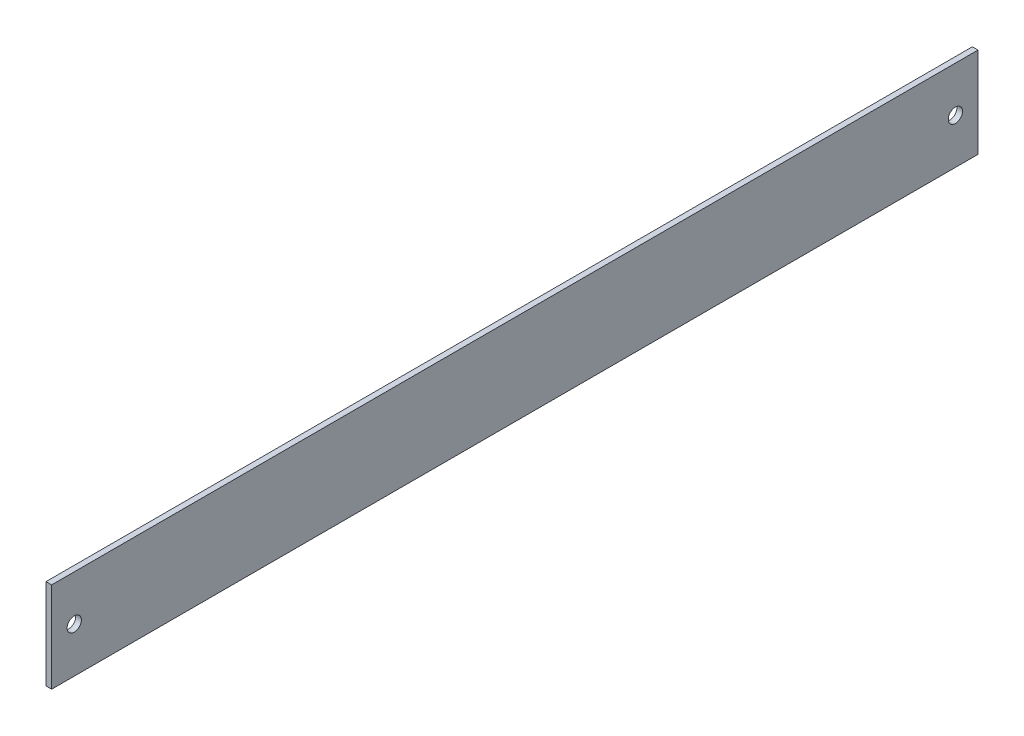
from build123d import *

# Parameters (mm, degrees)
SKETCH1_W           = 520.7
SKETCH1_H           = 50.8
SKETCH1_R           = 4
BOSS_EXTRUDE2_DEPTH = 3.175


with BuildPart() as part:
    # Sketch1 → Boss-Extrude2 (new body)
    with BuildSketch(Plane(origin=(0, 0, 0), x_dir=(0, 0, -1), z_dir=(1, 0, 0))):
        with Locations((260.35, 25.4)):
            Rectangle(SKETCH1_W, SKETCH1_H)
        with Locations((12.7, 25.4)):
            Circle(SKETCH1_R, mode=Mode.SUBTRACT)
        with Locations((508, 25.4)):
            Circle(SKETCH1_R, mode=Mode.SUBTRACT)
    extrude(amount=BOSS_EXTRUDE2_DEPTH)


solid = part.part
